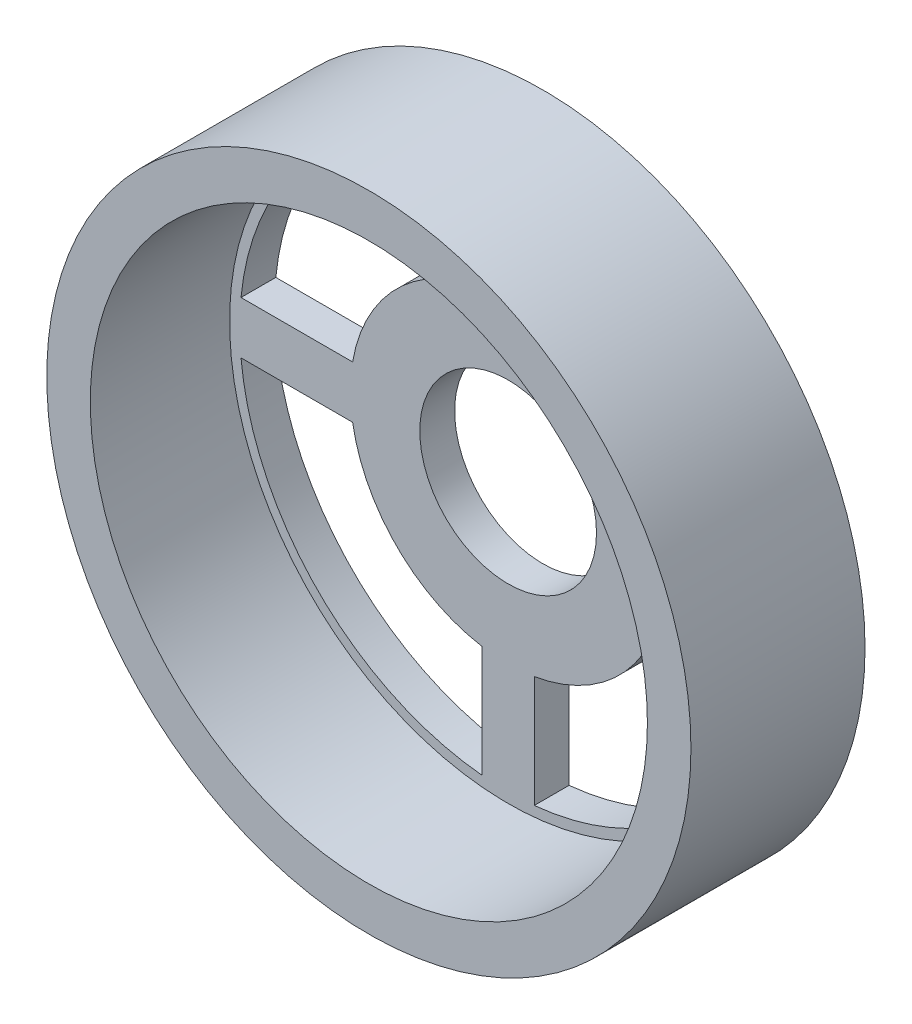
from build123d import *

# Parameters (mm, degrees)
ESBO_O1_R                = 16
ESBO_O1_R_2              = 5.075
RESSALTO_EXTRUS_O1_DEPTH = 2
ESBO_O2_R                = 18
ESBO_O2_R_2              = 16
RESSALTO_EXTRUS_O2_DEPTH = 10
CORTE_EXTRUS_O1_DEPTH    = 10
RESSALTO_EXTRUS_O3_START = -10
ESBO_O4_R                = 18.5
ESBO_O4_R_2              = 18
RESSALTO_EXTRUS_O3_DEPTH = 10


with BuildPart() as part:
    # Esboço1 → Ressalto-extrusão1 (new body)
    with BuildSketch(Plane.XY):
        Circle(ESBO_O1_R)
        Circle(ESBO_O1_R_2, mode=Mode.SUBTRACT)
    extrude(amount=RESSALTO_EXTRUS_O1_DEPTH)

    # Esboço2 → Ressalto-extrusão2 (add)
    with BuildSketch(Plane.XY):
        Circle(ESBO_O2_R)
        Circle(ESBO_O2_R_2, mode=Mode.SUBTRACT)
    extrude(amount=RESSALTO_EXTRUS_O2_DEPTH)

    # Esboço3 → Corte-extrusão1 (cut)
    with BuildSketch(Plane(origin=(0, 0, 0), x_dir=(-1, 0, 0), z_dir=(0, 0, -1))):
        with BuildLine():
            ThreePointArc((-1.5, -8.932222345), (-6.404474843, -6.404474843), (-8.932222345, -1.5))
            Line((-8.932222345, -1.5), (-15.344338178, -1.5))
            ThreePointArc((-15.344338178, -1.5), (-10.90180522, -10.90180522), (-1.5, -15.344338178))
            Line((-1.5, -15.344338178), (-1.5, -8.932222345))
        make_face()
        with BuildLine():
            ThreePointArc((8.932222345, -1.5), (6.404474843, -6.404474843), (1.5, -8.932222345))
            Line((1.5, -8.932222345), (1.5, -15.344338178))
            ThreePointArc((1.5, -15.344338178), (10.90180522, -10.90180522), (15.344338178, -1.5))
            Line((15.344338178, -1.5), (8.932222345, -1.5))
        make_face()
        with BuildLine():
            ThreePointArc((1.5, 8.932222345), (6.404474843, 6.404474843), (8.932222345, 1.5))
            Line((8.932222345, 1.5), (15.344338178, 1.5))
            ThreePointArc((15.344338178, 1.5), (10.90180522, 10.90180522), (1.5, 15.344338178))
            Line((1.5, 15.344338178), (1.5, 8.932222345))
        make_face()
        with BuildLine():
            ThreePointArc((-8.932222345, 1.5), (-6.404474843, 6.404474843), (-1.5, 8.932222345))
            Line((-1.5, 8.932222345), (-1.5, 15.344338178))
            ThreePointArc((-1.5, 15.344338178), (-10.90180522, 10.90180522), (-15.344338178, 1.5))
            Line((-15.344338178, 1.5), (-8.932222345, 1.5))
        make_face()
    extrude(amount=-CORTE_EXTRUS_O1_DEPTH, mode=Mode.SUBTRACT)

    # Esboço4 → Ressalto-extrusão3 (add)
    with BuildSketch(Plane.XY.offset(10).offset(RESSALTO_EXTRUS_O3_START)):
        Circle(ESBO_O4_R)
        Circle(ESBO_O4_R_2, mode=Mode.SUBTRACT)
    extrude(amount=RESSALTO_EXTRUS_O3_DEPTH)


solid = part.part
